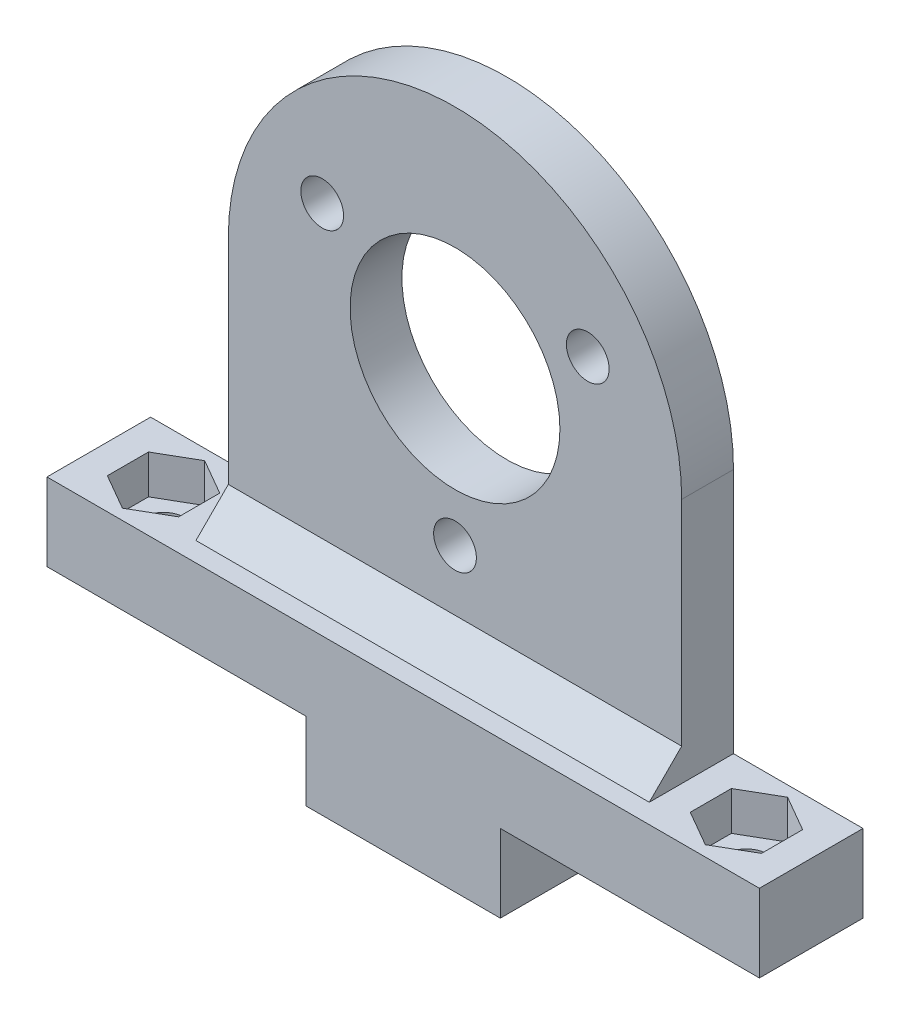
from build123d import *

# Parameters (mm, degrees)
ESQUISSE1_R             = 8.1
ESQUISSE1_R_2           = 1.65
BOSS_EXTRU_1_DEPTH      = 4
BOSS_EXTRU_2_DEPTH      = 4
CHANFREIN1_SIZE         = 2.5
ENL_V_MAT_EXTRU_1_DEPTH = 3
ESQUISSE5_R             = 1.6
ENL_V_MAT_EXTRU_2_DEPTH = 47.395042839


with BuildPart() as part:
    # Esquisse1 → Boss.-Extru.1 (new body)
    with BuildSketch(Plane.XY):
        with BuildLine():
            Line((-27.5, -19), (-27.5, -25))
            Line((-27.5, -25), (-7.5, -25))
            Line((-7.5, -25), (-7.5, -31))
            Line((-7.5, -31), (7.5, -31))
            Line((7.5, -31), (7.5, -25))
            Line((7.5, -25), (27.5, -25))
            Line((27.5, -25), (27.5, -19))
            Line((27.5, -19), (17.5, -19))
            Line((17.5, -19), (17.5, 0))
            ThreePointArc((17.5, 0), (0, 17.5), (-17.5, 0))
            Line((-17.5, 0), (-17.5, -19))
            Line((-17.5, -19), (-27.5, -19))
        make_face()
        Circle(ESQUISSE1_R, mode=Mode.SUBTRACT)
        with Locations((-10.25, 5.917840259)):
            Circle(ESQUISSE1_R_2, mode=Mode.SUBTRACT)
        with Locations((10.25, 5.917840259)):
            Circle(ESQUISSE1_R_2, mode=Mode.SUBTRACT)
        with Locations((0, -11.835680518)):
            Circle(ESQUISSE1_R_2, mode=Mode.SUBTRACT)
    extrude(amount=BOSS_EXTRU_1_DEPTH)

    # Esquisse2 → Boss.-Extru.2 (add)
    with BuildSketch(Plane.XY.offset(4)):
        Polygon((-27.5, -25), (-7.5, -25), (-7.5, -31), (7.5, -31), (7.5, -25), (27.5, -25), (27.5, -19), (-27.5, -19), align=None)
    extrude(amount=BOSS_EXTRU_2_DEPTH)

    # Chanfrein1
    chanfrein1_edges = [part.edges().sort_by_distance(p)[0] for p in [
        (0, -19, 4),
    ]]
    chamfer(chanfrein1_edges, length=CHANFREIN1_SIZE)

    # Esquisse3 → Enlèv. mat.-Extru.1 (cut)
    with BuildSketch(Plane(origin=(0, -19, 0), x_dir=(1, 0, 0), z_dir=(0, 1, 0))):
        Polygon((19.75, -2.41228676), (22.5, -0.824573519), (25.25, -2.41228676), (25.25, -5.58771324), (22.5, -7.175426481), (19.75, -5.58771324), align=None)
        Polygon((-22.5, -0.824573519), (-25.25, -2.41228676), (-25.25, -5.58771324), (-22.5, -7.175426481), (-19.75, -5.58771324), (-19.75, -2.41228676), align=None)
    extrude(amount=-ENL_V_MAT_EXTRU_1_DEPTH, mode=Mode.SUBTRACT)

    # Esquisse5 → Enlèv. mat.-Extru.2 (cut, through all)
    with BuildSketch(Plane(origin=(0, -19, 0), x_dir=(1, 0, 0), z_dir=(0, 1, 0))):
        with Locations(Location((-22.5, -4, 0), (0, 0, 270))):
            Circle(ESQUISSE5_R)
        with Locations(Location((22.5, -4, 0), (0, 0, 180))):
            Circle(ESQUISSE5_R)
    extrude(amount=-ENL_V_MAT_EXTRU_2_DEPTH, mode=Mode.SUBTRACT)


solid = part.part
